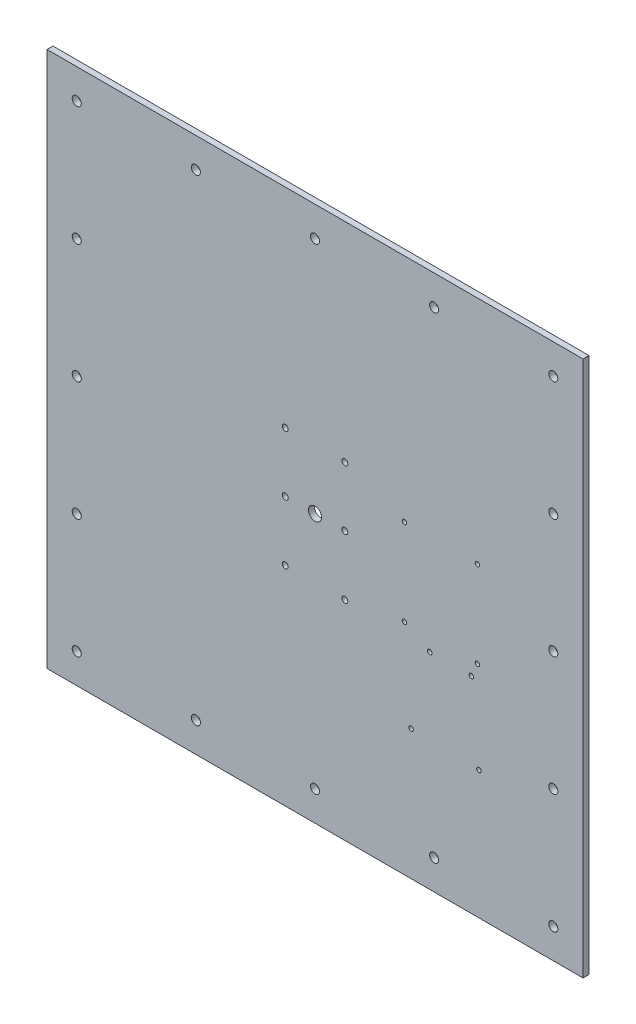
from build123d import *

# Parameters (mm, degrees)
SKETCH_1_W          = 360
SKETCH_1_H          = 360
SKETCH_1_R          = 2
SKETCH_1_R_2        = 4.4
EXTRUDE_1_DEPTH     = 4
SKETCH_2_R          = 1.5
CUT_EXTRUDE_2_DEPTH = 20
SKETCH_3_R          = 3.04
CUT_EXTRUDE_3_DEPTH = 20


with BuildPart() as part:
    # 草图1 → 凸台-拉伸1 (new body)
    with BuildSketch(Plane.XY):
        with Locations((-20, -0.443736876)):
            Rectangle(SKETCH_1_W, SKETCH_1_H)
        with Locations((-40, -0.443736876)):
            Circle(SKETCH_1_R, mode=Mode.SUBTRACT)
        with Locations((-40, 39.556263124)):
            Circle(SKETCH_1_R, mode=Mode.SUBTRACT)
        with Locations((0, 39.556263124)):
            Circle(SKETCH_1_R, mode=Mode.SUBTRACT)
        with Locations((0, -0.443736876)):
            Circle(SKETCH_1_R, mode=Mode.SUBTRACT)
        with Locations(Location((0, -40.443736876, 0), (0, 0, 180))):
            Circle(SKETCH_1_R, mode=Mode.SUBTRACT)
        with Locations(Location((-40, -40.443736876, 0), (0, 0, 180))):
            Circle(SKETCH_1_R, mode=Mode.SUBTRACT)
        with Locations((-20, -0.443736876)):
            Circle(SKETCH_1_R_2, mode=Mode.SUBTRACT)
    extrude(amount=EXTRUDE_1_DEPTH)

    # 草图2 → 切除-拉伸2 (cut)
    with BuildSketch(Plane.XY.offset(4)):
        with Locations((57.061153948, -42.313752709)):
            Circle(SKETCH_2_R)
        with Locations((84.961153948, -42.313752709)):
            Circle(SKETCH_2_R)
        with Locations((44.561153948, -93.113752709)):
            Circle(SKETCH_2_R)
        with Locations((90.061153948, -94.413752709)):
            Circle(SKETCH_2_R)
        with Locations((40.061153948, 24.768466173)):
            Circle(SKETCH_2_R)
        with Locations((89.061153948, 24.768466173)):
            Circle(SKETCH_2_R)
        with Locations((40.061153948, -33.231533827)):
            Circle(SKETCH_2_R)
        with Locations((89.061153948, -33.231533827)):
            Circle(SKETCH_2_R)
    extrude(amount=-CUT_EXTRUDE_2_DEPTH, mode=Mode.SUBTRACT)

    # 草图3 → 切除-拉伸3 (cut)
    with BuildSketch(Plane.XY.offset(4)):
        with Locations((-180, -160.443736876)):
            Circle(SKETCH_3_R)
        with Locations((-180, -80.443736876)):
            Circle(SKETCH_3_R)
        with Locations((-180, -0.443736876)):
            Circle(SKETCH_3_R)
        with Locations((-180, 79.556263124)):
            Circle(SKETCH_3_R)
        with Locations((-180, 159.556263124)):
            Circle(SKETCH_3_R)
        with Locations((-100, 159.556263124)):
            Circle(SKETCH_3_R)
        with Locations((-20, 159.556263124)):
            Circle(SKETCH_3_R)
        with Locations((60, 159.556263124)):
            Circle(SKETCH_3_R)
        with Locations((140, 159.556263124)):
            Circle(SKETCH_3_R)
        with Locations((140, 79.556263124)):
            Circle(SKETCH_3_R)
        with Locations((140, -0.443736876)):
            Circle(SKETCH_3_R)
        with Locations((140, -80.443736876)):
            Circle(SKETCH_3_R)
        with Locations((140, -160.443736876)):
            Circle(SKETCH_3_R)
        with Locations((60, -160.443736876)):
            Circle(SKETCH_3_R)
        with Locations((-20, -160.443736876)):
            Circle(SKETCH_3_R)
        with Locations((-100, -160.443736876)):
            Circle(SKETCH_3_R)
    extrude(amount=-CUT_EXTRUDE_3_DEPTH, mode=Mode.SUBTRACT)


solid = part.part
